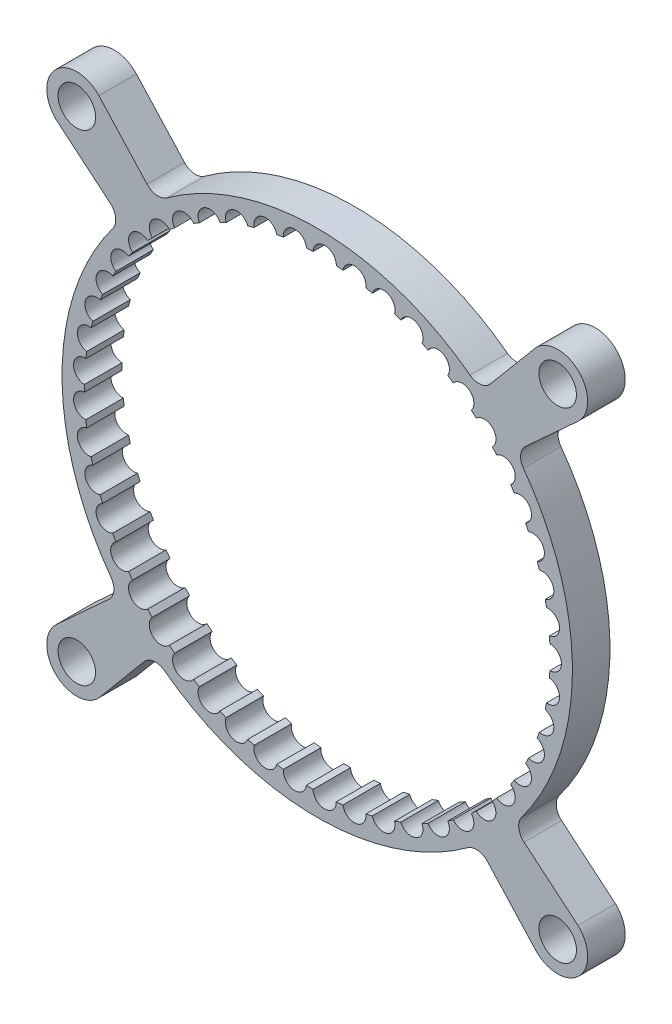
from build123d import *

# Parameters (mm, degrees)
SKETCH_1_R      = 2.5
EXTRUDE_1_DEPTH = 5


with BuildPart() as part:
    # 草图1 → 凸台-拉伸1 (new body)
    with BuildSketch(Plane.XY):
        with BuildLine():
            Line((29.084941375, -34.736280892), (22.681496979, -27.740758728))
            ThreePointArc((22.681496979, -27.740758728), (21.405560026, -27.101120587), (20.028107344, -27.474987101))
            ThreePointArc((20.028107344, -27.474987101), (-0.197152183, -33.999428392), (-20.34538772, -27.240873674))
            ThreePointArc((-20.34538772, -27.240873674), (-21.773876316, -26.856744694), (-23.075616614, -27.559316353))
            Line((-23.075616614, -27.559316353), (-29.084941375, -34.736280892))
            ThreePointArc((-29.084941375, -34.736280892), (-34.863899846, -34.863899846), (-34.736280892, -29.084941375))
            Line((-34.736280892, -29.084941375), (-27.740758728, -22.681496979))
            ThreePointArc((-27.740758728, -22.681496979), (-27.101120587, -21.405560026), (-27.474987101, -20.028107344))
            ThreePointArc((-27.474987101, -20.028107344), (-33.999428392, 0.197152183), (-27.240873674, 20.34538772))
            ThreePointArc((-27.240873674, 20.34538772), (-26.856744694, 21.773876316), (-27.559316353, 23.075616614))
            Line((-27.559316353, 23.075616614), (-34.736280892, 29.084941375))
            ThreePointArc((-34.736280892, 29.084941375), (-34.863899846, 34.863899846), (-29.084941375, 34.736280892))
            Line((-29.084941375, 34.736280892), (-22.681496979, 27.740758728))
            ThreePointArc((-22.681496979, 27.740758728), (-21.405560026, 27.101120587), (-20.028107344, 27.474987101))
            ThreePointArc((-20.028107344, 27.474987101), (0.197152183, 33.999428392), (20.34538772, 27.240873674))
            ThreePointArc((20.34538772, 27.240873674), (21.773876316, 26.856744694), (23.075616614, 27.559316353))
            Line((23.075616614, 27.559316353), (29.084941375, 34.736280892))
            ThreePointArc((29.084941375, 34.736280892), (34.863899846, 34.863899846), (34.736280892, 29.084941375))
            Line((34.736280892, 29.084941375), (27.740758728, 22.681496979))
            ThreePointArc((27.740758728, 22.681496979), (27.101120587, 21.405560026), (27.474987101, 20.028107344))
            ThreePointArc((27.474987101, 20.028107344), (33.999428392, -0.197152183), (27.240873674, -20.34538772))
            ThreePointArc((27.240873674, -20.34538772), (26.856744694, -21.773876316), (27.559316353, -23.075616614))
            Line((27.559316353, -23.075616614), (34.736280892, -29.084941375))
            ThreePointArc((34.736280892, -29.084941375), (34.863899846, -34.863899846), (29.084941375, -34.736280892))
        make_face()
        with Locations((32.035472722, -32.035472722)):
            Circle(SKETCH_1_R, mode=Mode.SUBTRACT)
        with Locations((-32.035472722, -32.035472722)):
            Circle(SKETCH_1_R, mode=Mode.SUBTRACT)
        with Locations((-32.035472722, 32.035472722)):
            Circle(SKETCH_1_R, mode=Mode.SUBTRACT)
        with Locations((32.035472722, 32.035472722)):
            Circle(SKETCH_1_R, mode=Mode.SUBTRACT)
        with BuildLine():
            Line((30.967380809, -1.988171813), (30.995571706, -1.54907584))
            ThreePointArc((30.995571706, -1.54907584), (32.086109964, -1.093363959), (32.535, 0))
            ThreePointArc((32.535, 0), (32.082923383, 1.086913605), (30.996191231, 1.539426235))
            Line((30.996191231, 1.539426235), (30.967380809, 1.988171813))
            Line((30.967380809, 1.988171813), (30.939189912, 2.427267786))
            ThreePointArc((30.939189912, 2.427267786), (31.962499724, 3.018693216), (32.2678881, 4.160483455))
            ThreePointArc((32.2678881, 4.160483455), (31.680531599, 5.18066324), (30.544855472, 5.490492524))
            Line((30.544855472, 5.490492524), (30.458897272, 5.931869712))
            Line((30.458897272, 5.931869712), (30.374787475, 6.363755741))
            ThreePointArc((30.374787475, 6.363755741), (31.314066123, 7.081183531), (31.470938369, 8.252651887))
            ThreePointArc((31.470938369, 8.252651887), (30.757946362, 9.189346528), (29.59197403, 9.351405078))
            Line((29.59197403, 9.351405078), (29.450279484, 9.778166475))
            Line((29.450279484, 9.778166475), (29.311631868, 10.195751004))
            ThreePointArc((29.311631868, 10.195751004), (30.151456422, 11.027401009), (30.1572367, 12.209312004))
            ThreePointArc((30.1572367, 12.209312004), (29.330316496, 13.047141), (28.153193193, 13.05876782))
            Line((28.153193193, 13.05876782), (27.958088921, 13.463906015))
            Line((27.958088921, 13.463906015), (27.767180076, 13.860332317))
            ThreePointArc((27.767180076, 13.860332317), (28.493760639, 14.792548867), (28.348354039, 15.965495554))
            ThreePointArc((28.348354039, 15.965495554), (27.421083643, 16.690701777), (26.252137703, 16.551705954))
            Line((26.252137703, 16.551705954), (26.006827311, 16.92856859))
            Line((26.006827311, 16.92856859), (25.766791955, 17.297327356))
            ThreePointArc((25.766791955, 17.297327356), (26.368198095, 18.314803482), (26.073992187, 19.45952611))
            ThreePointArc((26.073992187, 19.45952611), (25.061597356, 20.060201693), (23.920022836, 19.772865535))
            Line((23.920022836, 19.772865535), (23.628534316, 20.115264537))
            Line((23.628534316, 20.115264537), (23.343313822, 20.450300759))
            ThreePointArc((23.343313822, 20.450300759), (23.809670467, 21.536329529), (23.371496105, 22.634031784))
            ThreePointArc((23.371496105, 22.634031784), (22.290600333, 23.100313652), (21.195141857, 22.66935521))
            Line((21.195141857, 22.66935521), (20.86226144, 22.971668396))
            Line((20.86226144, 22.971668396), (20.536539122, 23.267480788))
            ThreePointArc((20.536539122, 23.267480788), (20.860188709, 24.404229642), (20.285240703, 25.436887282))
            ThreePointArc((20.285240703, 25.436887282), (19.153592268, 25.761119099), (18.122237234, 25.193614699))
            Line((18.122237234, 25.193614699), (17.753430809, 25.450878096))
            Line((17.753430809, 25.450878096), (17.392555017, 25.702609426))
            ThreePointArc((17.392555017, 25.702609426), (17.568183228, 26.871412978), (16.86590221, 27.822069794))
            ThreePointArc((16.86590221, 27.822069794), (15.702082748, 27.998927682), (14.751765976, 27.304195731))
            Line((14.751765976, 27.304195731), (14.353089334, 27.51218508))
            Line((14.353089334, 27.51218508), (13.962985639, 27.715701928))
            ThreePointArc((13.962985639, 27.715701928), (13.987708665, 28.897368456), (13.169626068, 29.75041469))
            ThreePointArc((13.169626068, 29.75041469), (11.992745464, 29.776994647), (11.139071129, 28.966442625))
            Line((11.139071129, 28.966442625), (10.717070529, 29.121742746))
            Line((10.717070529, 29.121742746), (10.304144423, 29.27370337))
            ThreePointArc((10.304144423, 29.27370337), (10.177556312, 30.448829943), (9.257105031, 31.190258599))
            ThreePointArc((9.257105031, 31.190258599), (8.08648763, 31.066124184), (7.343473042, 30.153061331))
            Line((7.343473042, 30.153061331), (6.905077723, 30.253122202))
            Line((6.905077723, 30.253122202), (6.476109441, 30.351031413))
            ThreePointArc((6.476109441, 30.351031413), (6.200288765, 31.500322484), (5.192582585, 32.117959323))
            ThreePointArc((5.192582585, 32.117959323), (4.047449894, 31.84514882), (3.427295331, 30.844567604))
            Line((3.427295331, 30.844567604), (2.979703731, 30.887746227))
            Line((2.979703731, 30.887746227), (2.541736921, 30.929996359))
            ThreePointArc((2.541736921, 30.929996359), (2.121212649, 32.034580601), (1.042798076, 32.518284044))
            ThreePointArc((1.042798076, 32.518284044), (-0.058046858, 32.101276993), (-0.545158475, 31.029606929))
            Line((-0.545158475, 31.029606929), (-0.994596914, 31.015194313))
            Line((-0.994596914, 31.015194313), (-1.434370849, 31.001091619))
            ThreePointArc((-1.434370849, 31.001091619), (-1.992693721, 32.04283179), (-3.124109148, 32.38465944))
            ThreePointArc((-3.124109148, 32.38465944), (-4.162590483, 31.830303085), (-4.508660794, 30.705140967))
            Line((-4.508660794, 30.705140967), (-4.952566305, 30.633373766))
            Line((-4.952566305, 30.633373766), (-5.38692629, 30.563149813))
            ThreePointArc((-5.38692629, 30.563149813), (-6.073880114, 31.524940566), (-7.239718586, 31.719279623))
            ThreePointArc((-7.239718586, 31.719279623), (-8.198784487, 31.03667648), (-8.398131027, 29.876497439))
            Line((-8.398131027, 29.876497439), (-8.829214694, 29.748554069))
            Line((-8.829214694, 29.748554069), (-9.25102855, 29.623361931))
            ThreePointArc((-9.25102855, 29.623361931), (-10.055333565, 30.489410691), (-11.236452046, 30.533070111))
            ThreePointArc((-11.236452046, 30.533070111), (-12.100354676, 29.733428506), (-12.149704181, 28.557282649))
            Line((-12.149704181, 28.557282649), (-12.560887622, 28.375263936))
            Line((-12.560887622, 28.375263936), (-12.963229176, 28.197159265))
            ThreePointArc((-12.963229176, 28.197159265), (-13.871678716, 28.953245534), (-15.048683273, 28.845508433))
            ThreePointArc((-15.048683273, 28.845508433), (-15.803237376, 27.941958458), (-15.701779528, 26.769158067))
            Line((-15.701779528, 26.769158067), (-16.086311123, 26.536052754))
            Line((-16.086311123, 26.536052754), (-16.462573939, 26.307960024))
            ThreePointArc((-16.462573939, 26.307960024), (-17.460251286, 26.941668887), (-18.613815537, 26.684304303))
            ThreePointArc((-18.613815537, 26.684304303), (-19.246631355, 25.691682224), (-18.996032089, 24.54148465))
            Line((-18.996032089, 24.54148465), (-19.347597839, 24.26112032))
            Line((-19.347597839, 24.26112032), (-19.691603692, 23.986784807))
            ThreePointArc((-19.691603692, 23.986784807), (-20.762127012, 24.487710781), (-21.873309465, 24.084944635))
            ThreePointArc((-21.873309465, 24.084944635), (-22.373996179, 23.019549278), (-21.978370329, 21.910840733))
            Line((-21.978370329, 21.910840733), (-22.291197534, 21.58782096))
            Line((-22.291197534, 21.58782096), (-22.597297857, 21.271747246))
            ThreePointArc((-22.597297857, 21.271747246), (-23.723089187, 21.631665141), (-24.773644256, 21.090110841))
            ThreePointArc((-24.773644256, 21.090110841), (-25.133980605, 19.96943597), (-24.599824335, 18.920421417))
            Line((-24.599824335, 18.920421417), (-24.868776382, 18.560050177))
            Line((-24.868776382, 18.560050177), (-25.131945015, 18.207428184))
            ThreePointArc((-25.131945015, 18.207428184), (-26.294518894, 18.420428158), (-27.267196493, 17.748978011))
            ThreePointArc((-27.267196493, 17.748978011), (-27.481265764, 16.591425075), (-26.817349906, 15.619329305))
            Line((-26.817349906, 15.619329305), (-27.038010609, 15.227523883))
            Line((-27.038010609, 15.227523883), (-27.253926332, 14.844143654))
            ThreePointArc((-27.253926332, 14.844143654), (-28.434193327, 14.906728253), (-29.313022117, 14.116407452))
            ThreePointArc((-29.313022117, 14.116407452), (-29.377309298, 12.940983439), (-28.594535333, 12.061768238))
            Line((-28.594535333, 12.061768238), (-28.763281449, 11.644962069))
            Line((-28.763281449, 11.644962069), (-28.928398932, 11.237118695))
            ThreePointArc((-28.928398932, 11.237118695), (-30.106979092, 11.148260283), (-30.877528729, 10.252045873))
            ThreePointArc((-30.877528729, 10.252045873), (-30.790978227, 9.078051213), (-29.902199281, 8.306153269))
            Line((-29.902199281, 8.306153269), (-30.016260004, 7.871190298))
            Line((-30.016260004, 7.871190298), (-30.127868021, 7.445580559))
            ThreePointArc((-30.127868021, 7.445580559), (-31.285409092, 7.206738187), (-31.935027173, 6.219345985))
            ThreePointArc((-31.935027173, 6.219345985), (-31.699060144, 5.066057637), (-30.718869943, 4.414151493))
            Line((-30.718869943, 4.414151493), (-30.776372398, 3.968173801))
            Line((-30.776372398, 3.968173801), (-30.832638349, 3.531786195))
            ThreePointArc((-30.832638349, 3.531786195), (-31.95013354, 3.146881649), (-32.468153353, 2.084524607))
            ThreePointArc((-32.468153353, 2.084524607), (-32.08664437, 0.970879535), (-31.031137609, 0.449669472))
            Line((-31.031137609, 0.449669472), (-31.031137609, 0))
            Line((-31.031137609, 0), (-31.031137609, -0.44))
            ThreePointArc((-31.031137609, -0.44), (-32.090237679, -0.964646598), (-32.468153353, -2.084524607))
            ThreePointArc((-32.468153353, -2.084524607), (-31.947366782, -3.140240383), (-30.833874854, -3.522196109))
            Line((-30.833874854, -3.522196109), (-30.776372398, -3.968173801))
            Line((-30.776372398, -3.968173801), (-30.720106447, -4.404561407))
            ThreePointArc((-30.720106447, -4.404561407), (-31.703421002, -5.060335375), (-31.935027173, -6.219345985))
            ThreePointArc((-31.935027173, -6.219345985), (-31.283514316, -7.19979764), (-30.130320726, -7.436227328))
            Line((-30.130320726, -7.436227328), (-30.016260004, -7.871190298))
            Line((-30.016260004, -7.871190298), (-29.904651987, -8.296800038))
            ThreePointArc((-29.904651987, -8.296800038), (-30.796035029, -9.072933585), (-30.877528729, -10.252045873))
            ThreePointArc((-30.877528729, -10.252045873), (-30.105987409, -11.141134419), (-28.932027565, -11.2281559))
            Line((-28.932027565, -11.2281559), (-28.763281449, -11.644962069))
            Line((-28.763281449, -11.644962069), (-28.598163967, -12.052805442))
            ThreePointArc((-28.598163967, -12.052805442), (-29.382979012, -12.936554477), (-29.313022117, -14.116407452))
            ThreePointArc((-29.313022117, -14.116407452), (-28.434121021, -14.899534079), (-27.258671312, -14.835718462))
            Line((-27.258671312, -14.835718462), (-27.038010609, -15.227523883))
            Line((-27.038010609, -15.227523883), (-26.822094886, -15.610904113))
            ThreePointArc((-26.822094886, -15.610904113), (-27.487455292, -16.587757501), (-27.267196493, -17.748978011))
            ThreePointArc((-27.267196493, -17.748978011), (-26.295367152, -18.413283801), (-25.137728429, -18.199678937))
            Line((-25.137728429, -18.199678937), (-24.868776382, -18.560050177))
            Line((-24.868776382, -18.560050177), (-24.605607749, -18.912672171))
            ThreePointArc((-24.605607749, -18.912672171), (-25.140588316, -19.966590006), (-24.773644256, -21.090110841))
            ThreePointArc((-24.773644256, -21.090110841), (-23.724844081, -21.624687913), (-22.60402474, -21.264801187))
            Line((-22.60402474, -21.264801187), (-22.291197534, -21.58782096))
            Line((-22.291197534, -21.58782096), (-21.985097212, -21.903894674))
            ThreePointArc((-21.985097212, -21.903894674), (-22.380913575, -23.017571655), (-21.873309465, -24.084944635))
            ThreePointArc((-21.873309465, -24.084944635), (-20.764759726, -24.481015246), (-19.699163589, -23.98075599))
            Line((-19.699163589, -23.98075599), (-19.347597839, -24.26112032))
            Line((-19.347597839, -24.26112032), (-19.003591987, -24.535455832))
            ThreePointArc((-19.003591987, -24.535455832), (-19.253744852, -25.690605414), (-18.613815537, -26.684304303))
            ThreePointArc((-18.613815537, -26.684304303), (-17.463718591, -26.935364987), (-16.470842718, -26.302947442))
            Line((-16.470842718, -26.302947442), (-16.086311123, -26.536052754))
            Line((-16.086311123, -26.536052754), (-15.710048307, -26.764145484))
            ThreePointArc((-15.710048307, -26.764145484), (-15.810430171, -27.941800142), (-15.048683273, -28.845508433))
            ThreePointArc((-15.048683273, -28.845508433), (-13.87592368, -28.947436778), (-12.972071064, -28.193245224))
            Line((-12.972071064, -28.193245224), (-12.560887622, -28.375263936))
            Line((-12.560887622, -28.375263936), (-12.158546068, -28.553368607))
            ThreePointArc((-12.158546068, -28.553368607), (-12.107508663, -29.734191284), (-11.236452046, -30.533070111))
            ThreePointArc((-11.236452046, -30.533070111), (-10.060286485, -30.484192458), (-9.260298362, -29.620610699))
            Line((-9.260298362, -29.620610699), (-8.829214694, -29.748554069))
            Line((-8.829214694, -29.748554069), (-8.407400839, -29.873746207))
            ThreePointArc((-8.407400839, -29.873746207), (-8.205782198, -31.038347828), (-7.239718586, -31.719279623))
            ThreePointArc((-7.239718586, -31.719279623), (-6.079459664, -31.520398541), (-5.396471817, -30.561606566))
            Line((-5.396471817, -30.561606566), (-4.952566305, -30.633373766))
            Line((-4.952566305, -30.633373766), (-4.51820632, -30.70359772))
            ThreePointArc((-4.51820632, -30.70359772), (-4.169317016, -31.832855558), (-3.124109148, -32.38465944))
            ThreePointArc((-3.124109148, -32.38465944), (-1.998808284, -32.039040551), (-1.444035353, -31.000781697))
            Line((-1.444035353, -31.000781697), (-0.994596914, -31.015194313))
            Line((-0.994596914, -31.015194313), (-0.554822979, -31.029297008))
            ThreePointArc((-0.554822979, -31.029297008), (-0.064391764, -32.10466868), (1.042798076, -32.518284044))
            ThreePointArc((1.042798076, -32.518284044), (2.114663474, -32.031602401), (2.53211213, -30.930924851))
            Line((2.53211213, -30.930924851), (2.979703731, -30.887746227))
            Line((2.979703731, -30.887746227), (3.41767054, -30.845496096))
            ThreePointArc((3.41767054, -30.845496096), (4.041590799, -31.84932403), (5.192582585, -32.117959323))
            ThreePointArc((5.192582585, -32.117959323), (6.193412515, -31.498206225), (6.466682403, -30.353183073))
            Line((6.466682403, -30.353183073), (6.905077723, -30.253122202))
            Line((6.905077723, -30.253122202), (7.334046004, -30.155212991))
            ThreePointArc((7.334046004, -30.155212991), (8.081210553, -31.07101436), (9.257105031, -31.190258599))
            ThreePointArc((9.257105031, -31.190258599), (10.170465894, -30.447610374), (10.295069929, -29.277042868))
            Line((10.295069929, -29.277042868), (10.717070529, -29.121742746))
            Line((10.717070529, -29.121742746), (11.129996635, -28.969782123))
            ThreePointArc((11.129996635, -28.969782123), (11.988137053, -29.782519493), (13.169626068, -29.75041469))
            ThreePointArc((13.169626068, -29.75041469), (13.980520504, -28.897065602), (13.954412692, -27.720174429))
            Line((13.954412692, -27.720174429), (14.353089334, -27.51218508))
            Line((14.353089334, -27.51218508), (14.743193029, -27.308668233))
            ThreePointArc((14.743193029, -27.308668233), (15.698218674, -28.004996479), (16.86590221, -27.822069794))
            ThreePointArc((16.86590221, -27.822069794), (17.561015355, -26.872031812), (17.384624384, -25.708141492))
            Line((17.384624384, -25.708141492), (17.753430809, -25.450878096))
            Line((17.753430809, -25.450878096), (18.114306601, -25.199146765))
            ThreePointArc((18.114306601, -25.199146765), (19.150535979, -25.767632198), (20.285240703, -25.436887282))
            ThreePointArc((20.285240703, -25.436887282), (20.853158818, -24.405760003), (20.529381024, -23.273981583))
            Line((20.529381024, -23.273981583), (20.86226144, -22.971668396))
            Line((20.86226144, -22.971668396), (21.187983759, -22.675856005))
            ThreePointArc((21.187983759, -22.675856005), (22.288402012, -23.107164108), (23.371496105, -22.634031784))
            ThreePointArc((23.371496105, -22.634031784), (23.80289399, -21.538746289), (23.337045796, -20.457663539))
            Line((23.337045796, -20.457663539), (23.628534316, -20.115264537))
            Line((23.628534316, -20.115264537), (23.91375481, -19.780228315))
            ThreePointArc((23.91375481, -19.780228315), (25.0602931, -20.067277022), (26.073992187, -19.45952611))
            ThreePointArc((26.073992187, -19.45952611), (26.361786301, -18.318066956), (25.76151692, -17.305431226))
            Line((25.76151692, -17.305431226), (26.006827311, -16.92856859))
            Line((26.006827311, -16.92856859), (26.246862668, -16.559809824))
            ThreePointArc((26.246862668, -16.559809824), (27.420694869, -16.697885803), (28.348354039, -15.965495554))
            ThreePointArc((28.348354039, -15.965495554), (28.48781881, -14.79660547), (27.762984649, -13.86904421))
            Line((27.762984649, -13.86904421), (27.958088921, -13.463906015))
            Line((27.958088921, -13.463906015), (28.148997767, -13.067479713))
            ThreePointArc((28.148997767, -13.067479713), (29.330849585, -13.05431576), (30.1572367, -12.209312004))
            ThreePointArc((30.1572367, -12.209312004), (30.146082121, -11.032184132), (29.308584938, -10.204927872))
            Line((29.308584938, -10.204927872), (29.450279484, -9.778166475))
            Line((29.450279484, -9.778166475), (29.5889271, -9.360581947))
            ThreePointArc((29.5889271, -9.360581947), (30.759392563, -9.196394213), (31.470938369, -8.252651887))
            ThreePointArc((31.470938369, -8.252651887), (31.309347598, -7.086614635), (30.372939072, -6.3732469))
            Line((30.372939072, -6.3732469), (30.458897272, -5.931869712))
            Line((30.458897272, -5.931869712), (30.543007069, -5.499983683))
            ThreePointArc((30.543007069, -5.499983683), (31.682867165, -5.187468128), (32.2678881, -4.160483455))
            ThreePointArc((32.2678881, -4.160483455), (31.958514452, -3.024683122), (30.938570387, -2.436917391))
            Line((30.938570387, -2.436917391), (30.967380809, -1.988171813))
        make_face(mode=Mode.SUBTRACT)
    extrude(amount=EXTRUDE_1_DEPTH)


solid = part.part
